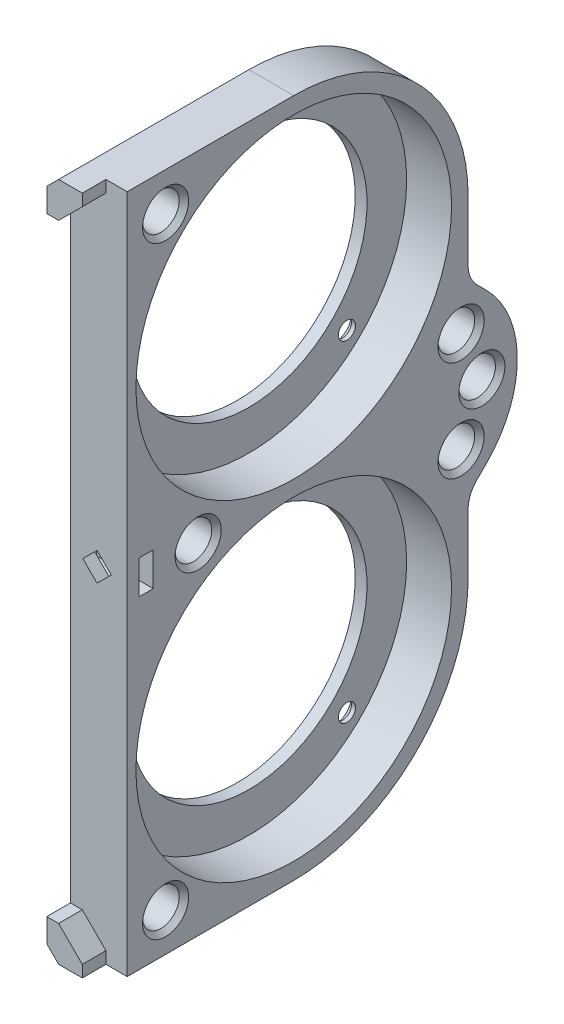
from build123d import *
from build123d.topology import SkipClean

# Parameters (mm, degrees)
BOSS_EXTRUDE1_DEPTH                               = 7.6
BOSS_EXTRUDE1_DEPTH_BACK                          = 2
CUT_EXTRUDE1_DEPTH                                = 70.244569428
CUT_EXTRUDE1_DEPTH_BACK                           = 70.244569428
SKETCH9_R                                         = 20
SKETCH10_R                                        = 3.1
CUT_EXTRUDE2_DEPTH                                = 70.244569428
SKETCH11_R                                        = 26.7
CUT_EXTRUDE3_DEPTH                                = 70.244569428
CUT_EXTRUDE4_DEPTH                                = 70.244569428
CUT_EXTRUDE4_DEPTH_BACK                           = 70.244569428
SKETCH12_W                                        = 5.7
SKETCH12_H                                        = 2.4
CUT_EXTRUDE5_START                                = 28.174078
CUT_EXTRUDE5_DEPTH                                = 6
M4_CLEARANCE_HOLE1_D                              = 4.5
BOSS_EXTRUDE2_DEPTH                               = 4
CHAMFER1_SIZE                                     = 2
CHAMFER2_SIZE                                     = 0.8
CSK_FOR_M2_5_FLAT_HEAD_MACHINE_SCREW1_D           = 2.9
CSK_FOR_M2_5_FLAT_HEAD_MACHINE_SCREW1_CSINK_D     = 5.5
CSK_FOR_M2_5_FLAT_HEAD_MACHINE_SCREW1_CSINK_ANGLE = 90
CIRPATTERN1_COUNT                                 = 3
LPATTERN1_COUNT                                   = 2
LPATTERN1_PITCH                                   = 56
LPATTERN1_COPY_1_D                                = 2.9
LPATTERN1_COPY_1_CSINK_D                          = 5.5
LPATTERN1_COPY_1_CSINK_ANGLE                      = 90
LPATTERN1_COPY_2_D                                = 2.9
LPATTERN1_COPY_2_CSINK_D                          = 5.5
LPATTERN1_COPY_2_CSINK_ANGLE                      = 90


with BuildPart() as part:
    # Sketch2 → Boss-Extrude1 (new, two sides: drawn at the far end of the back side and taken through both)
    with BuildSketch(Plane.YZ.offset(-BOSS_EXTRUDE1_DEPTH_BACK)):
        with BuildLine():
            Line((-12.727922061, -32.553844327), (-14.317300295, -30.964466094))
            ThreePointArc((-14.317300295, -30.964466094), (-15.939417039, -29.880602337), (-17.852834201, -29.5))
            Line((-17.852834201, -29.5), (-28, -29.5))
            ThreePointArc((-28, -29.5), (-48.859650045, -20.859650045), (-57.5, 0))
            Line((-57.5, 0), (-57.5, 28.174077734))
            Line((-57.5, 28.174077734), (0, 28.174077734))
            Line((0, 28.174077734), (0, -37.825922266))
            ThreePointArc((0, -37.825922266), (-6.888301783, -36.455753851), (-12.727922061, -32.553844327))
        make_face()
    extrude(amount=BOSS_EXTRUDE1_DEPTH + BOSS_EXTRUDE1_DEPTH_BACK)

    # Sketch9 → Cut-Extrude1 (cut, two sides: drawn at the far end of the back side and taken through both)
    with BuildSketch(Plane.YZ.offset(-CUT_EXTRUDE1_DEPTH_BACK)):
        with Locations(Location((-28, 0, 0), (0, 0, 90))):
            Circle(SKETCH9_R)
    extrude(amount=CUT_EXTRUDE1_DEPTH + CUT_EXTRUDE1_DEPTH_BACK, mode=Mode.SUBTRACT)

    # Sketch10 → Cut-Extrude2 (cut, through all)
    with BuildSketch(Plane.YZ):
        with Locations((0, 16.174077734)):
            Circle(SKETCH10_R)
        with Locations(Location((-8.485281374, -28.31120364, 0), (0, 0, 270))):
            Circle(SKETCH10_R)
        with Locations((0, -31.825922266)):
            Circle(SKETCH10_R)
        with Locations((8.485281374, -28.31120364)):
            Circle(SKETCH10_R)
        with Locations(Location((-51, 21.674077734, 0), (0, 0, 270))):
            Circle(SKETCH10_R)
    extrude(amount=CUT_EXTRUDE2_DEPTH, mode=Mode.SUBTRACT)

    # Sketch11 → Cut-Extrude3 (cut, through all)
    with BuildSketch(Plane.YZ):
        with Locations(Location((-28, 0, 0), (0, 0, 270))):
            Circle(SKETCH11_R)
    extrude(amount=CUT_EXTRUDE3_DEPTH, mode=Mode.SUBTRACT)

    # Sketch12 → Cut-Extrude4 (cut, two sides: drawn at the far end of the back side and taken through both)
    with BuildSketch(Plane.YZ.offset(-CUT_EXTRUDE4_DEPTH_BACK)):
        with Locations((0, 24.974077734)):
            Rectangle(SKETCH12_W, SKETCH12_H)
    extrude(amount=CUT_EXTRUDE4_DEPTH + CUT_EXTRUDE4_DEPTH_BACK, mode=Mode.SUBTRACT)

    # Sketch13 → Cut-Extrude5 (cut)
    with BuildSketch(Plane.XY.offset(CUT_EXTRUDE5_START)):
        Polygon((2.5, -2.404163056), (4.904163056, 0), (2.5, 2.404163056), (0.095836944, 0), align=None)
    extrude(amount=-CUT_EXTRUDE5_DEPTH, mode=Mode.SUBTRACT)

    # M4 Clearance Hole1 (through all)
    with Locations(Plane.ZY.offset(2)):
        with Locations((16.174077734, 0), (-28.31120364, -8.485281374), (-31.825922266, 0), (21.674077734, -51)):
            Hole(M4_CLEARANCE_HOLE1_D / 2)

    # Sketch20 → Boss-Extrude2 (add)
    with BuildSketch(Plane.XY.offset(28.174077734)):
        Polygon((-2, -51.5), (-2, -57.5), (4, -57.5), (4, -55.5), (0, -51.5), align=None)
    extrude(amount=BOSS_EXTRUDE2_DEPTH)

    # Chamfer1
    chamfer1_edges = [part.edges().sort_by_distance(p)[0] for p in [
        (-2, -48.859650045, -20.859650045),
        (-2, -22.9264171, -29.5),
        (-2, -15.939417039, -29.880602337),
        (-2, -13.522611178, -31.759155211),
        (-2, -6.888301783, -36.455753851),
        (-2, -57.5, 16.087038867),
    ]]
    chamfer(chamfer1_edges, length=CHAMFER1_SIZE)

    # Chamfer2
    chamfer2_edges = [part.edges().sort_by_distance(p)[0] for p in [
        (7.6, -3.1, 16.174077734),
        (7.6, -3.1, -31.825922266),
        (7.6, -8.485281374, -25.21120364),
        (7.6, -51, 24.774077734),
    ]]
    chamfer(chamfer2_edges, length=CHAMFER2_SIZE)

    # Mirror1: part across plane


with BuildPart() as part_1:
    with SkipClean():  # the faces are left unmerged after this step: merging them gives an invalid solid
        add(part.part)
        add(part.part.mirror(Plane(origin=(0, 0, 0), x_dir=(0, 0, 1), z_dir=(0, -1, 0))))

    # CSK for M2.5 Flat Head Machine Screw1 (through all)
    with Locations(Plane.ZY.offset(2)):
        with Locations((23.011048917, -33.878275914)):
            csk_for_m2_5_flat_head_machine_screw1 = CounterSinkHole(CSK_FOR_M2_5_FLAT_HEAD_MACHINE_SCREW1_D / 2, CSK_FOR_M2_5_FLAT_HEAD_MACHINE_SCREW1_CSINK_D / 2, counter_sink_angle=CSK_FOR_M2_5_FLAT_HEAD_MACHINE_SCREW1_CSINK_ANGLE)

    # CirPattern1: CSK for M2.5 Flat Head Machine Screw1 ×3 about axis
    with SkipClean():  # the faces are left unmerged after this step: merging them gives an invalid solid
        cirpattern1_axis = Axis((0, -28, 0), (1, 0, 0))
        for i in range(1, CIRPATTERN1_COUNT):
            add(csk_for_m2_5_flat_head_machine_screw1.rotate(cirpattern1_axis, i * 360 / CIRPATTERN1_COUNT), mode=Mode.SUBTRACT)

    # LPattern1: CSK for M2.5 Flat Head Machine Screw1 ×2
    with SkipClean():  # the faces are left unmerged after this step: merging them gives an invalid solid
        with Locations(*[(0, i * LPATTERN1_PITCH, 0) for i in range(1, LPATTERN1_COUNT)]):
            add(csk_for_m2_5_flat_head_machine_screw1, mode=Mode.SUBTRACT)

    # LPattern1 copy 1 (through all)
    with Locations(Plane(origin=(-2, 14, 24.248711306), x_dir=(-6.7609180727612354e-15, -0.8660254037844387, -0.4999999999999998), z_dir=(-1, 0, 0))):
        with Locations((23.011048917, -33.878275914)):
            CounterSinkHole(LPATTERN1_COPY_1_D / 2, LPATTERN1_COPY_1_CSINK_D / 2, counter_sink_angle=LPATTERN1_COPY_1_CSINK_ANGLE)

    # LPattern1 copy 2 (through all)
    with Locations(Plane(origin=(-2, 14, -24.248711306), x_dir=(-6.7609180727612354e-15, 0.8660254037844384, -0.5000000000000004), z_dir=(-1, 0, 0))):
        with Locations((23.011048917, -33.878275914)):
            CounterSinkHole(LPATTERN1_COPY_2_D / 2, LPATTERN1_COPY_2_CSINK_D / 2, counter_sink_angle=LPATTERN1_COPY_2_CSINK_ANGLE)


solid = part_1.part
